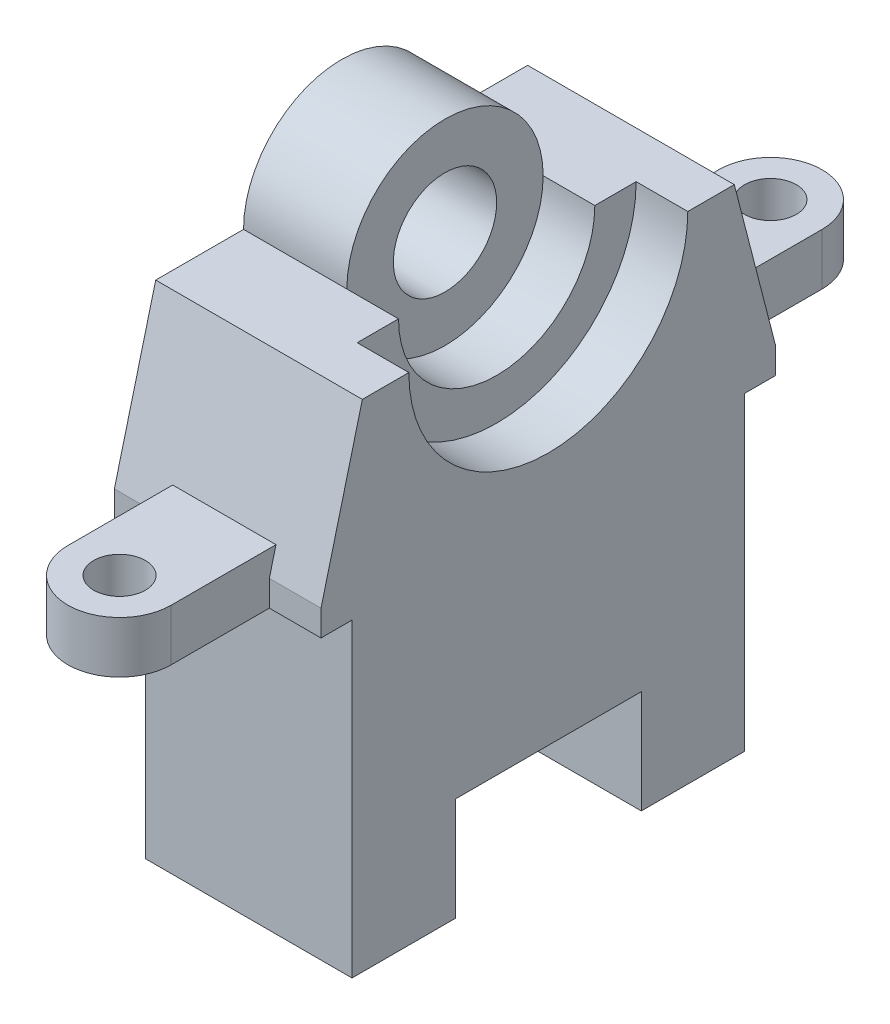
from build123d import *

# Parameters (mm, degrees)
SKETCH1_R           = 10
BOSS_EXTRUDE1_DEPTH = 20
BOSS_EXTRUDE2_DEPTH = 30
BOSS_EXTRUDE3_DEPTH = 40
SKETCH2_R           = 5
BOSS_EXTRUDE4_DEPTH = 10


with BuildPart() as part:
    # Sketch1 → Boss-Extrude1 (new body)
    with BuildSketch(Plane(origin=(0, 0, 0), x_dir=(0, 0, -1), z_dir=(1, 0, 0))):
        with BuildLine():
            ThreePointArc((-19, 0), (0, -19), (19, 0))
            ThreePointArc((19, 0), (0, 19), (-19, 0))
        make_face()
        Circle(SKETCH1_R, mode=Mode.SUBTRACT)
    extrude(amount=BOSS_EXTRUDE1_DEPTH)

    # Sketch1<3> → Boss-Extrude2 (add)
    with BuildSketch(Plane(origin=(0, 0, 0), x_dir=(0, 0, -1), z_dir=(1, 0, 0))):
        with BuildLine():
            ThreePointArc((-27, 0), (0, -27), (27, 0))
            Line((27, 0), (19, 0))
            ThreePointArc((19, 0), (0, -19), (-19, 0))
            Line((-19, 0), (-27, 0))
        make_face()
    extrude(amount=BOSS_EXTRUDE2_DEPTH)

    # Sketch1<4> → Boss-Extrude3 (add)
    with BuildSketch(Plane(origin=(0, 0, 0), x_dir=(0, 0, -1), z_dir=(1, 0, 0))):
        with BuildLine():
            Line((36, 0), (27, 0))
            ThreePointArc((27, 0), (0, -27), (-27, 0))
            Line((-27, 0), (-36, 0))
            Line((-36, 0), (-44, -31))
            Line((-44, -31), (-44, -36))
            Line((-44, -36), (-38, -36))
            Line((-38, -36), (-38, -96))
            Line((-38, -96), (-18, -96))
            Line((-18, -96), (-18, -76))
            Line((-18, -76), (18, -76))
            Line((18, -76), (18, -96))
            Line((18, -96), (38, -96))
            Line((38, -96), (38, -36))
            Line((38, -36), (44, -36))
            Line((44, -36), (44, -31))
            Line((44, -31), (36, 0))
        make_face()
    extrude(amount=BOSS_EXTRUDE3_DEPTH)

    # Sketch2 → Boss-Extrude4 (add)
    # profile 1 of 2: a face of its own
    with BuildSketch(Plane.XZ.offset(36)):
        with BuildLine():
            Line((10, -63), (10, -42))
            Line((10, -42), (30, -42))
            Line((30, -42), (30, -63))
            ThreePointArc((30, -63), (20, -73), (10, -63))
        make_face()
        with Locations((20, -63)):
            Circle(SKETCH2_R, mode=Mode.SUBTRACT)
    # profile 2 of 2: a face of its own
    with BuildSketch(Plane.XZ.offset(36)):
        with BuildLine():
            Line((30, 42), (30, 63))
            ThreePointArc((30, 63), (20, 73), (10, 63))
            Line((10, 63), (10, 42))
            Line((10, 42), (30, 42))
        make_face()
        with Locations((20, 63)):
            Circle(SKETCH2_R, mode=Mode.SUBTRACT)
    extrude(amount=-BOSS_EXTRUDE4_DEPTH)


solid = part.part
